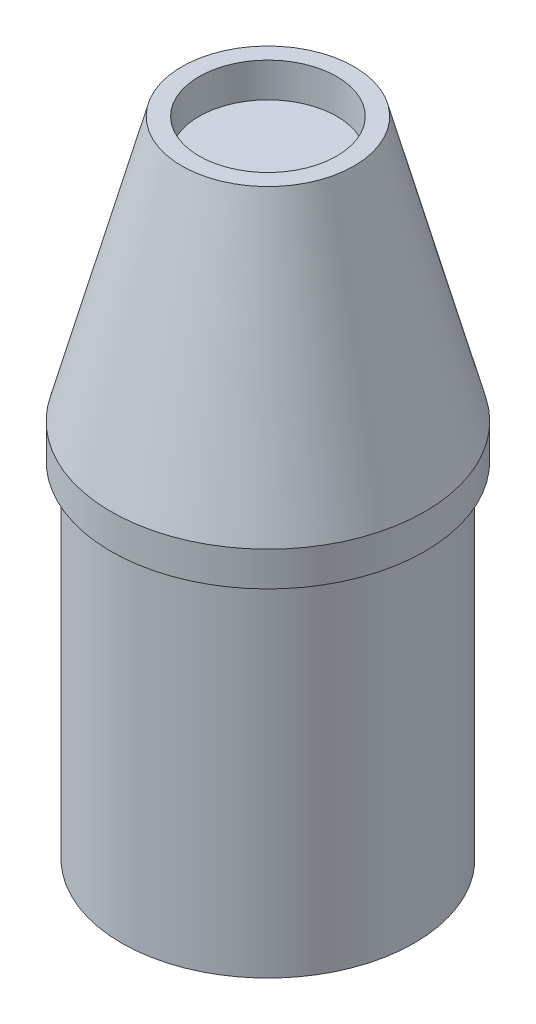
from build123d import *


with BuildPart() as part:
    # Sketch1 → Revolve1 (revolve)
    with BuildSketch(Plane.XY):
        Polygon((0, -4.249725563), (0, 107.927039915), (12.7, 107.927039915), (12.7, 114.277039915), (15.875, 114.277039915), (28.9179, 65.600274437), (28.9179, 59.250274437), (26.9875, 59.250274437), (26.9875, -4.249725563), align=None)
    revolve(axis=Axis((0, -4.249725563, 0), (0, 1, 0)))


solid = part.part
